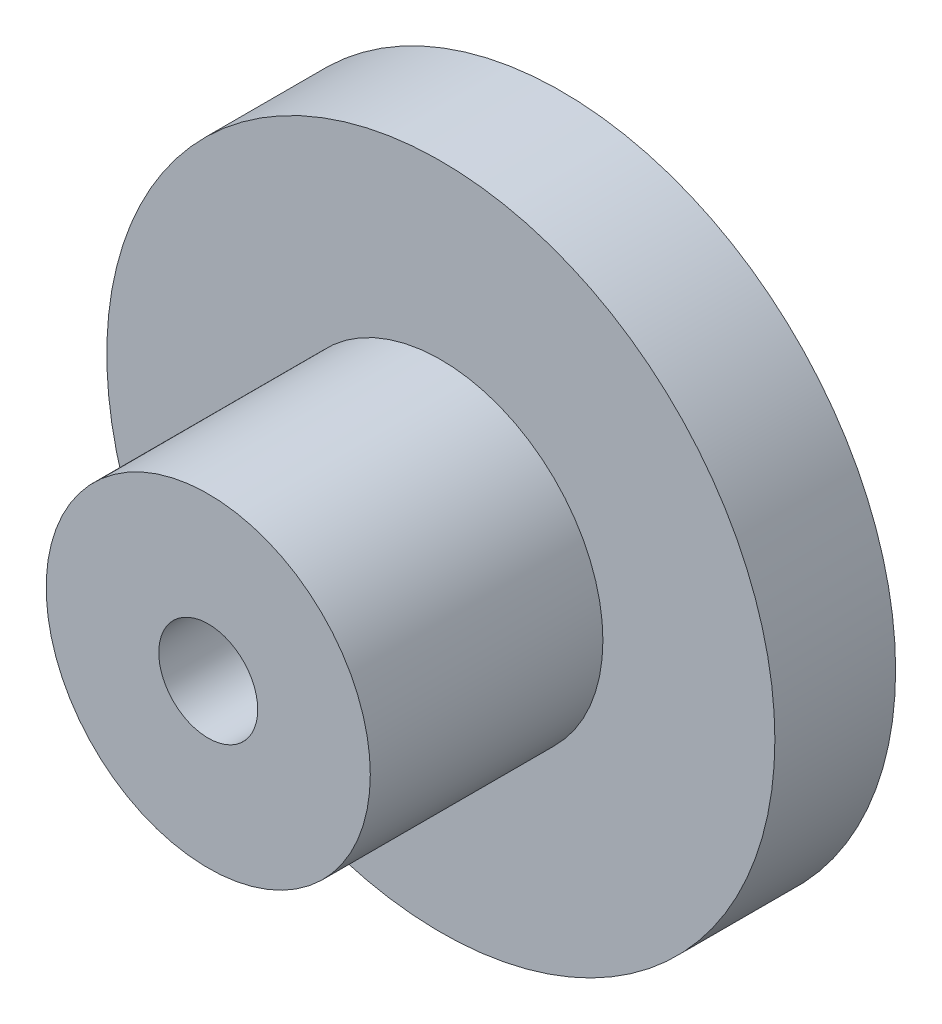
from build123d import *

# Parameters (mm, degrees)
SKETCH_1_R            = 6.75
EXTRUDE_T32_0_4_DEPTH = 2.44
SKETCH_2_R            = 3.275
EXTRUDE_T14_0_4_DEPTH = 4.7
SKETCH_3_R            = 1
CUT_EXTRUDE_1_DEPTH   = 12.920763398


with BuildPart() as part:
    # 草图1 → T32-0.4 (new body)
    with BuildSketch(Plane.XY):
        Circle(SKETCH_1_R)
    extrude(amount=EXTRUDE_T32_0_4_DEPTH)

    # 草图2 → T14-0.4 (add)
    with BuildSketch(Plane.XY.offset(2.44)):
        Circle(SKETCH_2_R)
    extrude(amount=EXTRUDE_T14_0_4_DEPTH)

    # 草图3 → 切除-拉伸1 (cut, through all)
    with BuildSketch(Plane.XY.offset(7.14)):
        Circle(SKETCH_3_R)
    extrude(amount=-CUT_EXTRUDE_1_DEPTH, mode=Mode.SUBTRACT)


solid = part.part
